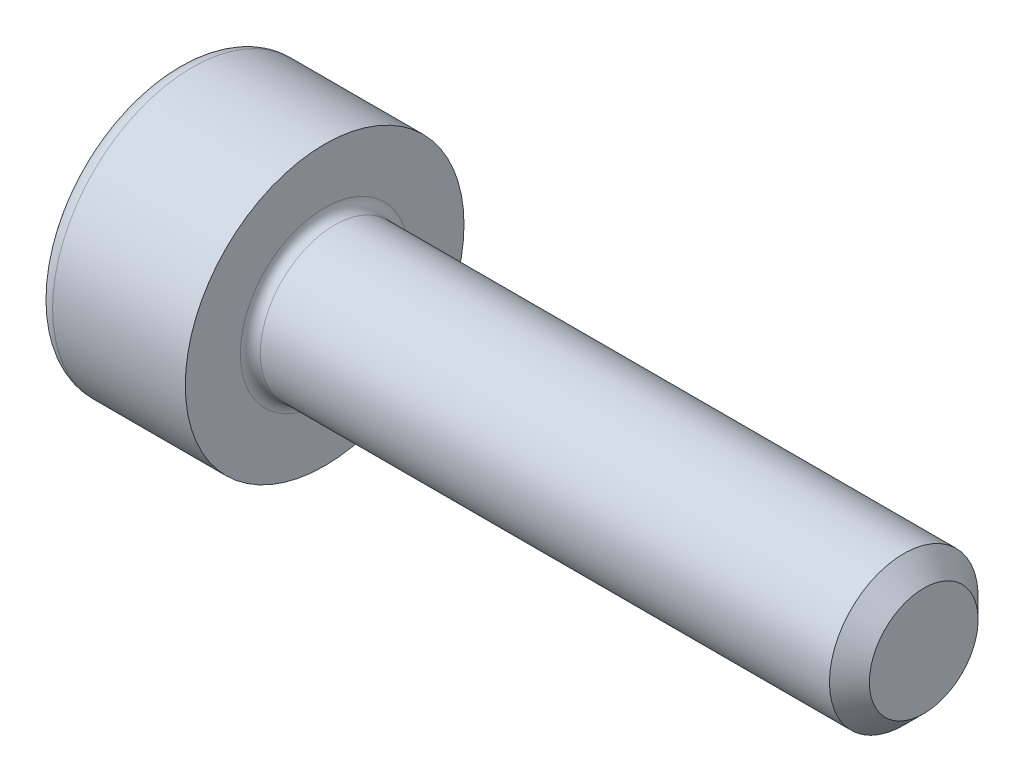
from build123d import *

# Parameters (mm, degrees)
FILLET1_R      = 0.1
FILLET2_R      = 0.16
CHAMFER1_SIZE  = 0.2
EXTRUDE1_DEPTH = 0.7


with BuildPart() as part:
    # Sketch1 → Revolve1 (revolve)
    with BuildSketch(Plane.XY, mode=Mode.PRIVATE) as revolve1_sk:
        Polygon((0, 1.395688245), (0, 0), (7.488734128, 0), (7.488734128, 0.744367064), (1.488734128, 0.744367064), (1.488734128, 1.395688245), align=None)
    revolve(revolve1_sk.sketch.rotate(Axis((0, 0, 0), (1, 0, 0)), 90), axis=Axis((0, 0, 0), (1, 0, 0)))

    # Fillet1
    fillet1_edges = [part.edges().sort_by_distance(p)[0] for p in [
        (1.488734128, 0, -0.744367064),
    ]]
    fillet(fillet1_edges, radius=FILLET1_R)

    # Fillet2
    fillet2_edges = [part.edges().sort_by_distance(p)[0] for p in [
        (0, 0, -1.395688245),
    ]]
    fillet(fillet2_edges, radius=FILLET2_R)

    # Chamfer1
    chamfer1_edges = [part.edges().sort_by_distance(p)[0] for p in [
        (7.488734128, 0, -0.744367064),
    ]]
    chamfer(chamfer1_edges, length=CHAMFER1_SIZE)

    # Sketch2 → Extrude1 (cut)
    with BuildSketch(Plane.ZY):
        Polygon((0, 0.877572409), (-0.76, 0.438786205), (-0.76, -0.438786205), (0, -0.877572409), (0.76, -0.438786205), (0.76, 0.438786205), align=None)
    extrude(amount=-EXTRUDE1_DEPTH, mode=Mode.SUBTRACT)


solid = part.part
